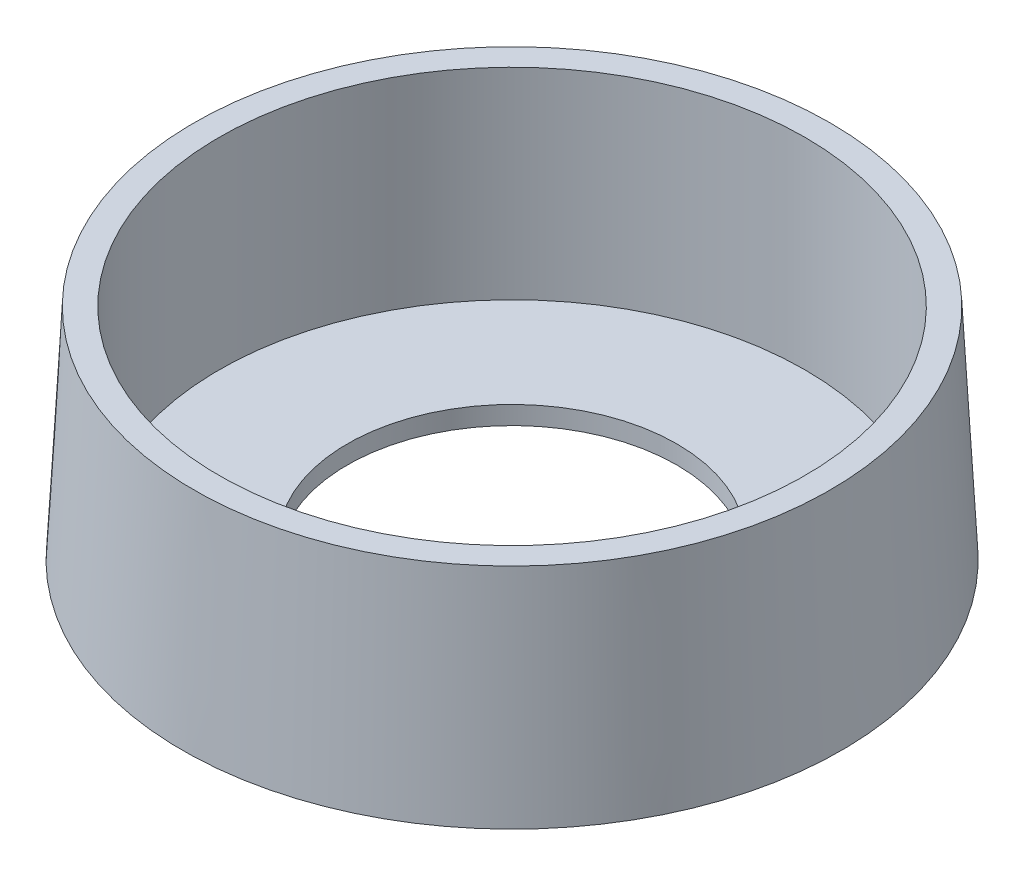
from build123d import *

# Parameters (mm, degrees)
DRAFT1_ANGLE = -3


with BuildPart() as part:
    # Sketch1 → Revolve1 (revolve)
    with BuildSketch(Plane(origin=(0, 0, 0), x_dir=(0, 0, -1), z_dir=(1, 0, 0)), mode=Mode.PRIVATE) as revolve1_sk:
        Polygon((-4.5, 0), (-9, 0), (-9, 6), (-8, 6), (-8, 0.5), (-4.5, 0.5), align=None)
    revolve(revolve1_sk.sketch.rotate(Axis((0, 0, 0), (0, 1, 0)), 180), axis=Axis((0, 0, 0), (0, 1, 0)))

    # Draft1
    draft1_faces = [part.faces().sort_by_distance(p)[0] for p in [
        (0, 3, 9),
    ]]
    draft(draft1_faces, Plane(origin=(0, 0, 4.5), x_dir=(0, 0, -1), z_dir=(0, -1, 0)), DRAFT1_ANGLE)


solid = part.part
